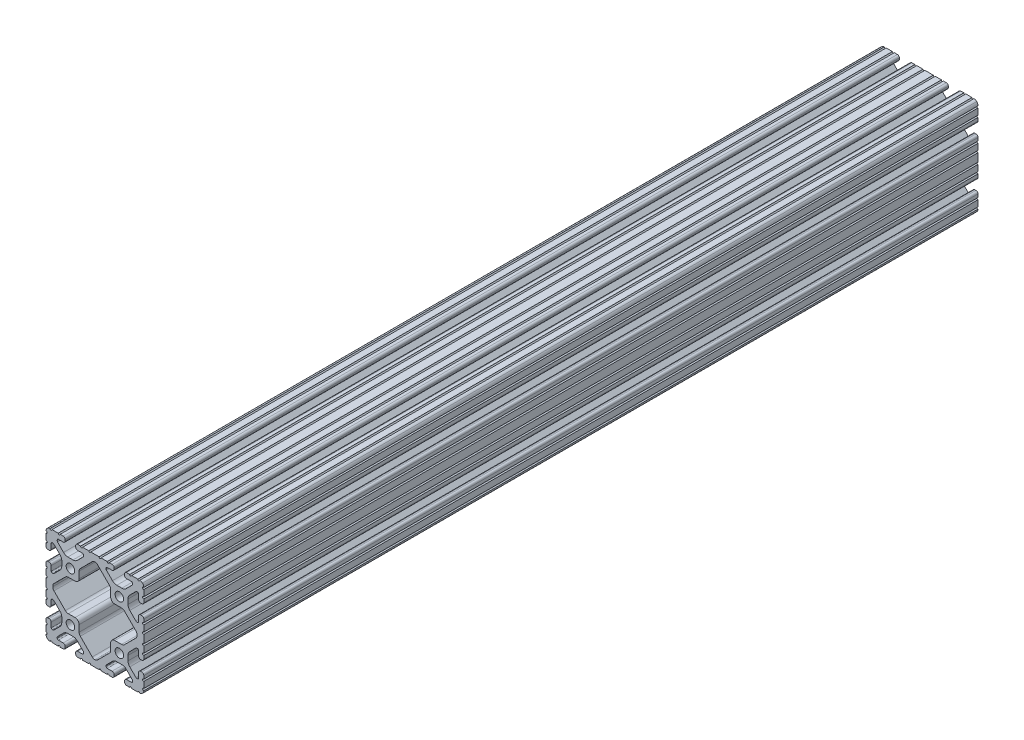
from build123d import *

# Parameters (mm, degrees)
BOSS_EXTRUDE1_DEPTH      = 325
BOSS_EXTRUDE1_DEPTH_BACK = 325
SKETCH3_R                = 3.3274


with BuildPart() as part:
    # Sketch3 → Boss-Extrude1 (new, two sides: drawn at the far end of the back side and taken through both)
    with BuildSketch(Plane.XY.offset(-BOSS_EXTRUDE1_DEPTH_BACK)):
        with BuildLine():
            Line((34.036, 28.448), (34.036, 24.630196049))
            ThreePointArc((34.036, 24.630196049), (34.497248241, 23.51664429), (35.6108, 23.055396049))
            Line((35.6108, 23.055396049), (36.525200183, 23.055396049))
            ThreePointArc((36.525200183, 23.055396049), (37.638751813, 23.516644236), (38.1, 24.630195866))
            Line((38.1, 24.630195866), (38.1, 27.023826138))
            ThreePointArc((38.1, 27.023826138), (37.117780706, 27.7845421), (38.1, 28.545258062))
            Line((38.1, 28.545258062), (38.1, 33.373016026))
            ThreePointArc((38.1, 33.373016026), (37.141472621, 34.109236774), (38.1, 34.845457521))
            ThreePointArc((38.1, 34.845457521), (37.837757813, 36.120195002), (37.086123144, 37.182631793))
            ThreePointArc((37.086123144, 37.182631793), (36.106286572, 37.843374398), (34.952681874, 38.1))
            ThreePointArc((34.952681874, 38.1), (34.190730434, 37.320215335), (33.428778994, 38.1))
            Line((33.428778994, 38.1), (28.601105935, 38.1))
            ThreePointArc((28.601105935, 38.1), (27.839158581, 37.32021942), (27.077211227, 38.1))
            Line((27.077211227, 38.1), (24.6888, 38.1))
            ThreePointArc((24.6888, 38.1), (23.575248241, 37.638751759), (23.114, 36.5252))
            Line((23.114, 36.5252), (23.114, 35.6108))
            ThreePointArc((23.114, 35.6108), (23.575248241, 34.497248241), (24.6888, 34.036))
            Line((24.6888, 34.036), (28.448, 34.036))
            ThreePointArc((28.448, 34.036), (29.076617928, 33.775617928), (29.337, 33.147))
            Line((29.337, 33.147), (29.337, 32.720693454))
            ThreePointArc((29.337, 32.720693454), (29.326675076, 32.273872751), (29.100231244, 31.888543625))
            Line((29.100231244, 31.888543625), (24.409287499, 27.197588341))
            ThreePointArc((24.409287499, 27.197588341), (22.868340045, 26.167958114), (21.050667579, 25.8064))
            Line((21.050667579, 25.8064), (17.049332421, 25.8064))
            ThreePointArc((17.049332421, 25.8064), (15.231659955, 26.167958114), (13.690712501, 27.197588341))
            Line((13.690712501, 27.197588341), (9.023381298, 31.864931024))
            ThreePointArc((9.023381298, 31.864931024), (8.830670886, 32.153343113), (8.763, 32.493548179))
            Line((8.763, 32.493548179), (8.763, 33.147))
            ThreePointArc((8.763, 33.147), (9.023382072, 33.775617928), (9.652, 34.036))
            Line((9.652, 34.036), (13.4112, 34.036))
            ThreePointArc((13.4112, 34.036), (14.524751759, 34.497248241), (14.986, 35.6108))
            Line((14.986, 35.6108), (14.986, 36.5252))
            ThreePointArc((14.986, 36.5252), (14.524751759, 37.638751759), (13.4112, 38.1))
            Line((13.4112, 38.1), (11.128867074, 38.1))
            ThreePointArc((11.128867074, 38.1), (10.367071033, 37.320370693), (9.605274992, 38.1))
            Line((9.605274992, 38.1), (4.777313069, 38.1))
            ThreePointArc((4.777313069, 38.1), (4.015517029, 37.320370693), (3.253720988, 38.1))
            Line((3.253720988, 38.1), (-3.253720988, 38.1))
            ThreePointArc((-3.253720988, 38.1), (-4.015517029, 37.320370693), (-4.777313069, 38.1))
            Line((-4.777313069, 38.1), (-9.605274992, 38.1))
            ThreePointArc((-9.605274992, 38.1), (-10.367071033, 37.320370693), (-11.128867074, 38.1))
            Line((-11.128867074, 38.1), (-13.4112, 38.1))
            ThreePointArc((-13.4112, 38.1), (-14.524751759, 37.638751759), (-14.986, 36.5252))
            Line((-14.986, 36.5252), (-14.986, 35.6108))
            ThreePointArc((-14.986, 35.6108), (-14.524751759, 34.497248241), (-13.4112, 34.036))
            Line((-13.4112, 34.036), (-9.652, 34.036))
            ThreePointArc((-9.652, 34.036), (-9.023382072, 33.775617928), (-8.763, 33.147))
            Line((-8.763, 33.147), (-8.763, 32.493548179))
            ThreePointArc((-8.763, 32.493548179), (-8.830670886, 32.153343113), (-9.023381298, 31.864931024))
            Line((-9.023381298, 31.864931024), (-13.690712501, 27.197588341))
            ThreePointArc((-13.690712501, 27.197588341), (-15.231659955, 26.167958114), (-17.049332421, 25.8064))
            Line((-17.049332421, 25.8064), (-21.050667579, 25.8064))
            ThreePointArc((-21.050667579, 25.8064), (-22.868340045, 26.167958114), (-24.409287499, 27.197588341))
            Line((-24.409287499, 27.197588341), (-29.100231244, 31.888543625))
            ThreePointArc((-29.100231244, 31.888543625), (-29.326675076, 32.273872751), (-29.337, 32.720693454))
            Line((-29.337, 32.720693454), (-29.337, 33.147))
            ThreePointArc((-29.337, 33.147), (-29.076617928, 33.775617928), (-28.448, 34.036))
            Line((-28.448, 34.036), (-24.6888, 34.036))
            ThreePointArc((-24.6888, 34.036), (-23.575248241, 34.497248241), (-23.114, 35.6108))
            Line((-23.114, 35.6108), (-23.114, 36.5252))
            ThreePointArc((-23.114, 36.5252), (-23.575248241, 37.638751759), (-24.6888, 38.1))
            Line((-24.6888, 38.1), (-27.077211227, 38.1))
            ThreePointArc((-27.077211227, 38.1), (-27.839158581, 37.32021942), (-28.601105935, 38.1))
            Line((-28.601105935, 38.1), (-33.428778994, 38.1))
            ThreePointArc((-33.428778994, 38.1), (-34.190730434, 37.320215335), (-34.952681874, 38.1))
            ThreePointArc((-34.952681874, 38.1), (-36.106286572, 37.843374398), (-37.086123144, 37.182631793))
            ThreePointArc((-37.086123144, 37.182631793), (-37.837757813, 36.120195002), (-38.1, 34.845457521))
            ThreePointArc((-38.1, 34.845457521), (-37.141472621, 34.109236774), (-38.1, 33.373016026))
            Line((-38.1, 33.373016026), (-38.1, 28.545258062))
            ThreePointArc((-38.1, 28.545258062), (-37.117780706, 27.7845421), (-38.1, 27.023826138))
            Line((-38.1, 27.023826138), (-38.1, 24.630195866))
            ThreePointArc((-38.1, 24.630195866), (-37.638751813, 23.516644236), (-36.525200183, 23.055396049))
            Line((-36.525200183, 23.055396049), (-35.6108, 23.055396049))
            ThreePointArc((-35.6108, 23.055396049), (-34.497248241, 23.51664429), (-34.036, 24.630196049))
            Line((-34.036, 24.630196049), (-34.036, 28.448))
            ThreePointArc((-34.036, 28.448), (-33.775617928, 29.076617928), (-33.147, 29.337))
            Line((-33.147, 29.337), (-32.664287242, 29.337))
            ThreePointArc((-32.664287242, 29.337), (-32.324081166, 29.269328695), (-32.03566854, 29.076617155))
            Line((-32.03566854, 29.076617155), (-27.19758008, 24.238516795))
            ThreePointArc((-27.19758008, 24.238516795), (-26.167955879, 22.697572205), (-25.8064, 20.879905136))
            Line((-25.8064, 20.879905136), (-25.8064, 17.220094864))
            ThreePointArc((-25.8064, 17.220094864), (-26.167955879, 15.402427795), (-27.19758008, 13.861483205))
            Line((-27.19758008, 13.861483205), (-31.948944541, 9.110107057))
            ThreePointArc((-31.948944541, 9.110107057), (-32.333417096, 8.853210196), (-32.786933649, 8.763))
            Line((-32.786933649, 8.763), (-33.060275787, 8.763))
            ThreePointArc((-33.060275787, 8.763), (-33.750216995, 9.048783005), (-34.036, 9.738724213))
            Line((-34.036, 9.738724213), (-34.036, 13.469803585))
            ThreePointArc((-34.036, 13.469803585), (-34.497248348, 14.583355603), (-35.610800366, 15.044603951))
            Line((-35.610800366, 15.044603951), (-36.5252, 15.044603951))
            ThreePointArc((-36.5252, 15.044603951), (-37.638751759, 14.58335571), (-38.1, 13.469803951))
            Line((-38.1, 13.469803951), (-38.1, 11.075039289))
            ThreePointArc((-38.1, 11.075039289), (-37.117000248, 10.313517272), (-38.1, 9.551995255))
            Line((-38.1, 9.551995255), (-38.1, 4.723759308))
            ThreePointArc((-38.1, 4.723759308), (-37.117000248, 3.962237292), (-38.1, 3.200715275))
            Line((-38.1, 3.200715275), (-38.1, -3.200715275))
            ThreePointArc((-38.1, -3.200715275), (-37.117000248, -3.962237292), (-38.1, -4.723759308))
            Line((-38.1, -4.723759308), (-38.1, -9.551995255))
            ThreePointArc((-38.1, -9.551995255), (-37.117000248, -10.313517272), (-38.1, -11.075039289))
            Line((-38.1, -11.075039289), (-38.1, -13.469803951))
            ThreePointArc((-38.1, -13.469803951), (-37.638751759, -14.58335571), (-36.5252, -15.044603951))
            Line((-36.5252, -15.044603951), (-35.610800366, -15.044603951))
            ThreePointArc((-35.610800366, -15.044603951), (-34.497248348, -14.583355603), (-34.036, -13.469803585))
            Line((-34.036, -13.469803585), (-34.036, -9.738724213))
            ThreePointArc((-34.036, -9.738724213), (-33.750216995, -9.048783005), (-33.060275787, -8.763))
            Line((-33.060275787, -8.763), (-32.786933649, -8.763))
            ThreePointArc((-32.786933649, -8.763), (-32.333417096, -8.853210196), (-31.948944541, -9.110107057))
            Line((-31.948944541, -9.110107057), (-27.19758008, -13.861483205))
            ThreePointArc((-27.19758008, -13.861483205), (-26.167955879, -15.402427795), (-25.8064, -17.220094864))
            Line((-25.8064, -17.220094864), (-25.8064, -20.879905136))
            ThreePointArc((-25.8064, -20.879905136), (-26.167955879, -22.697572205), (-27.19758008, -24.238516795))
            Line((-27.19758008, -24.238516795), (-32.03566854, -29.076617155))
            ThreePointArc((-32.03566854, -29.076617155), (-32.324081166, -29.269328695), (-32.664287242, -29.337))
            Line((-32.664287242, -29.337), (-33.147, -29.337))
            ThreePointArc((-33.147, -29.337), (-33.775617928, -29.076617928), (-34.036, -28.448))
            Line((-34.036, -28.448), (-34.036, -24.630196049))
            ThreePointArc((-34.036, -24.630196049), (-34.497248241, -23.51664429), (-35.6108, -23.055396049))
            Line((-35.6108, -23.055396049), (-36.525200183, -23.055396049))
            ThreePointArc((-36.525200183, -23.055396049), (-37.638751813, -23.516644236), (-38.1, -24.630195866))
            Line((-38.1, -24.630195866), (-38.1, -27.023826138))
            ThreePointArc((-38.1, -27.023826138), (-37.117780706, -27.7845421), (-38.1, -28.545258062))
            Line((-38.1, -28.545258062), (-38.1, -33.373016026))
            ThreePointArc((-38.1, -33.373016026), (-37.141472621, -34.109236774), (-38.1, -34.845457521))
            ThreePointArc((-38.1, -34.845457521), (-37.837757813, -36.120195002), (-37.086123144, -37.182631793))
            ThreePointArc((-37.086123144, -37.182631793), (-36.106286572, -37.843374398), (-34.952681874, -38.1))
            ThreePointArc((-34.952681874, -38.1), (-34.190730434, -37.320215335), (-33.428778994, -38.1))
            Line((-33.428778994, -38.1), (-28.601105935, -38.1))
            ThreePointArc((-28.601105935, -38.1), (-27.839158581, -37.32021942), (-27.077211227, -38.1))
            Line((-27.077211227, -38.1), (-24.6888, -38.1))
            ThreePointArc((-24.6888, -38.1), (-23.575248241, -37.638751759), (-23.114, -36.5252))
            Line((-23.114, -36.5252), (-23.114, -35.6108))
            ThreePointArc((-23.114, -35.6108), (-23.575248241, -34.497248241), (-24.6888, -34.036))
            Line((-24.6888, -34.036), (-28.448, -34.036))
            ThreePointArc((-28.448, -34.036), (-29.076617928, -33.775617928), (-29.337, -33.147))
            Line((-29.337, -33.147), (-29.337, -32.720693454))
            ThreePointArc((-29.337, -32.720693454), (-29.326675076, -32.273872751), (-29.100231244, -31.888543625))
            Line((-29.100231244, -31.888543625), (-24.409287499, -27.197588341))
            ThreePointArc((-24.409287499, -27.197588341), (-22.868340045, -26.167958114), (-21.050667579, -25.8064))
            Line((-21.050667579, -25.8064), (-17.049332421, -25.8064))
            ThreePointArc((-17.049332421, -25.8064), (-15.231659955, -26.167958114), (-13.690712501, -27.197588341))
            Line((-13.690712501, -27.197588341), (-9.023381298, -31.864931024))
            ThreePointArc((-9.023381298, -31.864931024), (-8.830670886, -32.153343113), (-8.763, -32.493548179))
            Line((-8.763, -32.493548179), (-8.763, -33.147))
            ThreePointArc((-8.763, -33.147), (-9.023382072, -33.775617928), (-9.652, -34.036))
            Line((-9.652, -34.036), (-13.4112, -34.036))
            ThreePointArc((-13.4112, -34.036), (-14.524751759, -34.497248241), (-14.986, -35.6108))
            Line((-14.986, -35.6108), (-14.986, -36.5252))
            ThreePointArc((-14.986, -36.5252), (-14.524751759, -37.638751759), (-13.4112, -38.1))
            Line((-13.4112, -38.1), (-11.128867074, -38.1))
            ThreePointArc((-11.128867074, -38.1), (-10.367071033, -37.320370693), (-9.605274992, -38.1))
            Line((-9.605274992, -38.1), (-4.777313069, -38.1))
            ThreePointArc((-4.777313069, -38.1), (-4.015517029, -37.320370693), (-3.253720988, -38.1))
            Line((-3.253720988, -38.1), (3.253720988, -38.1))
            ThreePointArc((3.253720988, -38.1), (4.015517029, -37.320370693), (4.777313069, -38.1))
            Line((4.777313069, -38.1), (9.605274992, -38.1))
            ThreePointArc((9.605274992, -38.1), (10.367071033, -37.320370693), (11.128867074, -38.1))
            Line((11.128867074, -38.1), (13.4112, -38.1))
            ThreePointArc((13.4112, -38.1), (14.524751759, -37.638751759), (14.986, -36.5252))
            Line((14.986, -36.5252), (14.986, -35.6108))
            ThreePointArc((14.986, -35.6108), (14.524751759, -34.497248241), (13.4112, -34.036))
            Line((13.4112, -34.036), (9.652, -34.036))
            ThreePointArc((9.652, -34.036), (9.023382072, -33.775617928), (8.763, -33.147))
            Line((8.763, -33.147), (8.763, -32.493548179))
            ThreePointArc((8.763, -32.493548179), (8.830670886, -32.153343113), (9.023381298, -31.864931024))
            Line((9.023381298, -31.864931024), (13.690712501, -27.197588341))
            ThreePointArc((13.690712501, -27.197588341), (15.231659955, -26.167958114), (17.049332421, -25.8064))
            Line((17.049332421, -25.8064), (21.050667579, -25.8064))
            ThreePointArc((21.050667579, -25.8064), (22.868340045, -26.167958114), (24.409287499, -27.197588341))
            Line((24.409287499, -27.197588341), (29.100231244, -31.888543625))
            ThreePointArc((29.100231244, -31.888543625), (29.326675076, -32.273872751), (29.337, -32.720693454))
            Line((29.337, -32.720693454), (29.337, -33.147))
            ThreePointArc((29.337, -33.147), (29.076617928, -33.775617928), (28.448, -34.036))
            Line((28.448, -34.036), (24.6888, -34.036))
            ThreePointArc((24.6888, -34.036), (23.575248241, -34.497248241), (23.114, -35.6108))
            Line((23.114, -35.6108), (23.114, -36.5252))
            ThreePointArc((23.114, -36.5252), (23.575248241, -37.638751759), (24.6888, -38.1))
            Line((24.6888, -38.1), (27.077211227, -38.1))
            ThreePointArc((27.077211227, -38.1), (27.839158581, -37.32021942), (28.601105935, -38.1))
            Line((28.601105935, -38.1), (33.428778994, -38.1))
            ThreePointArc((33.428778994, -38.1), (34.190730434, -37.320215335), (34.952681874, -38.1))
            ThreePointArc((34.952681874, -38.1), (36.106286572, -37.843374398), (37.086123144, -37.182631793))
            ThreePointArc((37.086123144, -37.182631793), (37.837757813, -36.120195002), (38.1, -34.845457521))
            ThreePointArc((38.1, -34.845457521), (37.141472621, -34.109236774), (38.1, -33.373016026))
            Line((38.1, -33.373016026), (38.1, -28.545258062))
            ThreePointArc((38.1, -28.545258062), (37.117780706, -27.7845421), (38.1, -27.023826138))
            Line((38.1, -27.023826138), (38.1, -24.630195866))
            ThreePointArc((38.1, -24.630195866), (37.638751813, -23.516644236), (36.525200183, -23.055396049))
            Line((36.525200183, -23.055396049), (35.6108, -23.055396049))
            ThreePointArc((35.6108, -23.055396049), (34.497248241, -23.51664429), (34.036, -24.630196049))
            Line((34.036, -24.630196049), (34.036, -28.448))
            ThreePointArc((34.036, -28.448), (33.775617928, -29.076617928), (33.147, -29.337))
            Line((33.147, -29.337), (32.664287242, -29.337))
            ThreePointArc((32.664287242, -29.337), (32.324081166, -29.269328695), (32.03566854, -29.076617155))
            Line((32.03566854, -29.076617155), (27.19758008, -24.238516795))
            ThreePointArc((27.19758008, -24.238516795), (26.167955879, -22.697572205), (25.8064, -20.879905136))
            Line((25.8064, -20.879905136), (25.8064, -17.220094864))
            ThreePointArc((25.8064, -17.220094864), (26.167955879, -15.402427795), (27.19758008, -13.861483205))
            Line((27.19758008, -13.861483205), (31.948944541, -9.110107057))
            ThreePointArc((31.948944541, -9.110107057), (32.333417096, -8.853210196), (32.786933649, -8.763))
            Line((32.786933649, -8.763), (33.060275787, -8.763))
            ThreePointArc((33.060275787, -8.763), (33.750216995, -9.048783005), (34.036, -9.738724213))
            Line((34.036, -9.738724213), (34.036, -13.469803585))
            ThreePointArc((34.036, -13.469803585), (34.497248348, -14.583355603), (35.610800366, -15.044603951))
            Line((35.610800366, -15.044603951), (36.5252, -15.044603951))
            ThreePointArc((36.5252, -15.044603951), (37.638751759, -14.58335571), (38.1, -13.469803951))
            Line((38.1, -13.469803951), (38.1, -11.075039289))
            ThreePointArc((38.1, -11.075039289), (37.117000248, -10.313517272), (38.1, -9.551995255))
            Line((38.1, -9.551995255), (38.1, -4.723759308))
            ThreePointArc((38.1, -4.723759308), (37.117000248, -3.962237292), (38.1, -3.200715275))
            Line((38.1, -3.200715275), (38.1, 3.200715275))
            ThreePointArc((38.1, 3.200715275), (37.117000248, 3.962237292), (38.1, 4.723759308))
            Line((38.1, 4.723759308), (38.1, 9.551995255))
            ThreePointArc((38.1, 9.551995255), (37.117000248, 10.313517272), (38.1, 11.075039289))
            Line((38.1, 11.075039289), (38.1, 13.469803951))
            ThreePointArc((38.1, 13.469803951), (37.638751759, 14.58335571), (36.5252, 15.044603951))
            Line((36.5252, 15.044603951), (35.610800366, 15.044603951))
            ThreePointArc((35.610800366, 15.044603951), (34.497248348, 14.583355603), (34.036, 13.469803585))
            Line((34.036, 13.469803585), (34.036, 9.738724213))
            ThreePointArc((34.036, 9.738724213), (33.750216995, 9.048783005), (33.060275787, 8.763))
            Line((33.060275787, 8.763), (32.786933649, 8.763))
            ThreePointArc((32.786933649, 8.763), (32.333417096, 8.853210196), (31.948944541, 9.110107057))
            Line((31.948944541, 9.110107057), (27.19758008, 13.861483205))
            ThreePointArc((27.19758008, 13.861483205), (26.167955879, 15.402427795), (25.8064, 17.220094864))
            Line((25.8064, 17.220094864), (25.8064, 20.879905136))
            ThreePointArc((25.8064, 20.879905136), (26.167955879, 22.697572205), (27.19758008, 24.238516795))
            Line((27.19758008, 24.238516795), (32.03566854, 29.076617155))
            ThreePointArc((32.03566854, 29.076617155), (32.324081166, 29.269328695), (32.664287242, 29.337))
            Line((32.664287242, 29.337), (33.147, 29.337))
            ThreePointArc((33.147, 29.337), (33.775617928, 29.076617928), (34.036, 28.448))
        make_face()
        with Locations((19.05, 19.05)):
            Circle(SKETCH3_R, mode=Mode.SUBTRACT)
        with Locations((-19.05, 19.05)):
            Circle(SKETCH3_R, mode=Mode.SUBTRACT)
        with Locations((19.05, -19.05)):
            Circle(SKETCH3_R, mode=Mode.SUBTRACT)
        with Locations((-19.05, -19.05)):
            Circle(SKETCH3_R, mode=Mode.SUBTRACT)
        with BuildLine():
            Line((-11.363666791, -22.843321003), (-2.051515952, -32.155494748))
            ThreePointArc((-2.051515952, -32.155494748), (-1.11031328, -32.786013752), (0, -33.011005091))
            ThreePointArc((0, -33.011005091), (1.11031328, -32.786013752), (2.051515952, -32.155494748))
            Line((2.051515952, -32.155494748), (11.363666791, -22.843321003))
            ThreePointArc((11.363666791, -22.843321003), (12.051918263, -21.813277828), (12.2936, -20.598259734))
            Line((12.2936, -20.598259734), (12.2936, -15.4686))
            ThreePointArc((12.2936, -15.4686), (13.22353597, -13.22353597), (15.4686, -12.2936))
            Line((15.4686, -12.2936), (20.769026744, -12.2936))
            ThreePointArc((20.769026744, -12.2936), (21.984048446, -12.051916769), (23.014093535, -11.363661269))
            Line((23.014093535, -11.363661269), (31.902125566, -2.475607377))
            ThreePointArc((31.902125566, -2.475607377), (32.607298578, -1.335259481), (32.728725173, 0))
            ThreePointArc((32.728725173, 0), (32.607298578, 1.335259481), (31.902125566, 2.475607377))
            Line((31.902125566, 2.475607377), (23.014093535, 11.363661269))
            ThreePointArc((23.014093535, 11.363661269), (21.984048446, 12.051916769), (20.769026744, 12.2936))
            Line((20.769026744, 12.2936), (15.4686, 12.2936))
            ThreePointArc((15.4686, 12.2936), (13.22353597, 13.22353597), (12.2936, 15.4686))
            Line((12.2936, 15.4686), (12.2936, 20.598259734))
            ThreePointArc((12.2936, 20.598259734), (12.051918263, 21.813277828), (11.363666791, 22.843321003))
            Line((11.363666791, 22.843321003), (2.051515952, 32.155494748))
            ThreePointArc((2.051515952, 32.155494748), (1.11031328, 32.786013752), (0, 33.011005091))
            ThreePointArc((0, 33.011005091), (-1.11031328, 32.786013752), (-2.051515952, 32.155494748))
            Line((-2.051515952, 32.155494748), (-11.363666791, 22.843321003))
            ThreePointArc((-11.363666791, 22.843321003), (-12.051918263, 21.813277828), (-12.2936, 20.598259734))
            Line((-12.2936, 20.598259734), (-12.2936, 15.4686))
            ThreePointArc((-12.2936, 15.4686), (-13.22353597, 13.22353597), (-15.4686, 12.2936))
            Line((-15.4686, 12.2936), (-20.769026744, 12.2936))
            ThreePointArc((-20.769026744, 12.2936), (-21.984048446, 12.051916769), (-23.014093535, 11.363661269))
            Line((-23.014093535, 11.363661269), (-31.902125566, 2.475607377))
            ThreePointArc((-31.902125566, 2.475607377), (-32.607298578, 1.335259481), (-32.728725173, 0))
            ThreePointArc((-32.728725173, 0), (-32.607298578, -1.335259481), (-31.902125566, -2.475607377))
            Line((-31.902125566, -2.475607377), (-23.014093535, -11.363661269))
            ThreePointArc((-23.014093535, -11.363661269), (-21.984048446, -12.051916769), (-20.769026744, -12.2936))
            Line((-20.769026744, -12.2936), (-15.4686, -12.2936))
            ThreePointArc((-15.4686, -12.2936), (-13.22353597, -13.22353597), (-12.2936, -15.4686))
            Line((-12.2936, -15.4686), (-12.2936, -20.598259734))
            ThreePointArc((-12.2936, -20.598259734), (-12.051918263, -21.813277828), (-11.363666791, -22.843321003))
        make_face(mode=Mode.SUBTRACT)
    extrude(amount=BOSS_EXTRUDE1_DEPTH + BOSS_EXTRUDE1_DEPTH_BACK)


solid = part.part
